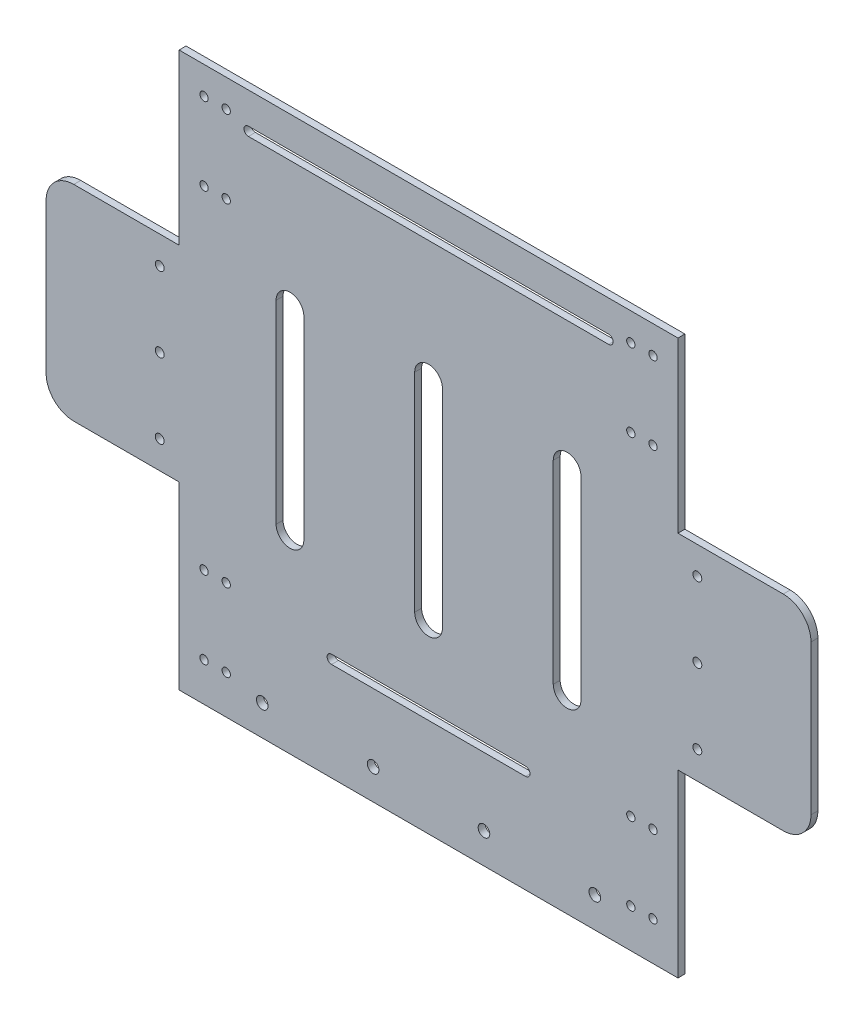
from build123d import *

# Parameters (mm, degrees)
EXTRUDE_1_DEPTH     = 2.5
CUT_EXTRUDE_1_DEPTH = 171.441338882
FILLET_1_R          = 10
FILLET_2_R          = 10
FILLET_3_R          = 10
FILLET_4_R          = 10
SKETCH_5_R          = 2.1
CUT_EXTRUDE_2_DEPTH = 171.441338882
SKETCH_6_R          = 1.5
CUT_EXTRUDE_3_DEPTH = 171.441338882
SKETCH_7_R          = 1.6
CUT_EXTRUDE_4_DEPTH = 171.441338882
CUT_EXTRUDE_5_DEPTH = 171.441338882
CUT_EXTRUDE_6_DEPTH = 171.441338882


with BuildPart() as part:
    # 草图1 → 凸台-拉伸1 (new body)
    with BuildSketch(Plane.XY):
        Polygon((-90, -35), (-90, -100), (90, -100), (90, -35), (138, -35), (138, 39), (90, 39), (90, 100), (-90, 100), (-90, 39), (-138, 39), (-138, -35), align=None)
    extrude(amount=EXTRUDE_1_DEPTH)

    # 草图4 → 切除-拉伸1 (cut, through all)
    with BuildSketch(Plane.XY.offset(2.5)):
        with BuildLine():
            Line((-45, 39.306212286), (-45, -30.693787714))
            ThreePointArc((-45, -30.693787714), (-50, -35.693787714), (-55, -30.693787714))
            Line((-55, -30.693787714), (-55, 39.306212286))
            ThreePointArc((-55, 39.306212286), (-50, 44.306212286), (-45, 39.306212286))
        make_face()
        with BuildLine():
            Line((5, 41.806212286), (5, -33.193787714))
            ThreePointArc((5, -33.193787714), (0, -38.193787714), (-5, -33.193787714))
            Line((-5, -33.193787714), (-5, 41.806212286))
            ThreePointArc((-5, 41.806212286), (0, 46.806212286), (5, 41.806212286))
        make_face()
        with BuildLine():
            Line((55, 39.306212286), (55, -30.693787714))
            ThreePointArc((55, -30.693787714), (50, -35.693787714), (45, -30.693787714))
            Line((45, -30.693787714), (45, 39.306212286))
            ThreePointArc((45, 39.306212286), (50, 44.306212286), (55, 39.306212286))
        make_face()
    extrude(amount=-CUT_EXTRUDE_1_DEPTH, mode=Mode.SUBTRACT)

    # 圆角1
    fillet_1_edges = [part.edges().sort_by_distance(p)[0] for p in [
        (-138, 39, 1.25),
    ]]
    fillet(fillet_1_edges, radius=FILLET_1_R)

    # 圆角2
    fillet_2_edges = [part.edges().sort_by_distance(p)[0] for p in [
        (-138, -35, 1.25),
    ]]
    fillet(fillet_2_edges, radius=FILLET_2_R)

    # 圆角3
    fillet_3_edges = [part.edges().sort_by_distance(p)[0] for p in [
        (138, -35, 1.25),
    ]]
    fillet(fillet_3_edges, radius=FILLET_3_R)

    # 圆角4
    fillet_4_edges = [part.edges().sort_by_distance(p)[0] for p in [
        (138, 39, 1.25),
    ]]
    fillet(fillet_4_edges, radius=FILLET_4_R)

    # 草图5 → 切除-拉伸2 (cut, through all)
    with BuildSketch(Plane(origin=(0, 0, 0), x_dir=(-1, 0, 0), z_dir=(0, 0, -1))):
        with Locations((-60, -89)):
            Circle(SKETCH_5_R)
        with Locations((-20, -89)):
            Circle(SKETCH_5_R)
        with Locations((20, -89)):
            Circle(SKETCH_5_R)
        with Locations((60, -89)):
            Circle(SKETCH_5_R)
    extrude(amount=-CUT_EXTRUDE_2_DEPTH, mode=Mode.SUBTRACT)

    # 草图6 → 切除-拉伸3 (cut, through all)
    with BuildSketch(Plane.XY.offset(2.5)):
        with Locations((-81, 90)):
            Circle(SKETCH_6_R)
        with Locations((-73, 90)):
            Circle(SKETCH_6_R)
        with Locations((-81, 62)):
            Circle(SKETCH_6_R)
        with Locations((-73, 62)):
            Circle(SKETCH_6_R)
        with Locations((73, 90)):
            Circle(SKETCH_6_R)
        with Locations((81, 90)):
            Circle(SKETCH_6_R)
        with Locations((73, 62)):
            Circle(SKETCH_6_R)
        with Locations((81, 62)):
            Circle(SKETCH_6_R)
        with Locations((-81, -58)):
            Circle(SKETCH_6_R)
        with Locations((-73, -58)):
            Circle(SKETCH_6_R)
        with Locations((-81, -86)):
            Circle(SKETCH_6_R)
        with Locations((-73, -86)):
            Circle(SKETCH_6_R)
        with Locations((73, -58)):
            Circle(SKETCH_6_R)
        with Locations((81, -58)):
            Circle(SKETCH_6_R)
        with Locations((73, -86)):
            Circle(SKETCH_6_R)
        with Locations((81, -86)):
            Circle(SKETCH_6_R)
    extrude(amount=-CUT_EXTRUDE_3_DEPTH, mode=Mode.SUBTRACT)

    # 草图7 → 切除-拉伸4 (cut, through all)
    with BuildSketch(Plane.XY.offset(2.5)):
        with Locations((-97, 29)):
            Circle(SKETCH_7_R)
        with Locations((-97, 2)):
            Circle(SKETCH_7_R)
        with Locations((-97, -25)):
            Circle(SKETCH_7_R)
        with Locations((97, 29)):
            Circle(SKETCH_7_R)
        with Locations((97, 2)):
            Circle(SKETCH_7_R)
        with Locations((97, -25)):
            Circle(SKETCH_7_R)
    extrude(amount=-CUT_EXTRUDE_4_DEPTH, mode=Mode.SUBTRACT)

    # 草图8 → 切除-拉伸5 (cut, through all)
    with BuildSketch(Plane.XY.offset(2.5)):
        with BuildLine():
            Line((-35, -61.3), (35, -61.3))
            ThreePointArc((35, -61.3), (36.6, -62.9), (35, -64.5))
            Line((35, -64.5), (-35, -64.5))
            ThreePointArc((-35, -64.5), (-36.6, -62.9), (-35, -61.3))
        make_face()
    extrude(amount=-CUT_EXTRUDE_5_DEPTH, mode=Mode.SUBTRACT)

    # 草图9 → 切除-拉伸6 (cut, through all)
    with BuildSketch(Plane.XY.offset(2.5)):
        with BuildLine():
            Line((65, 88.7), (-65, 88.7))
            ThreePointArc((-65, 88.7), (-66.6, 87.1), (-65, 85.5))
            Line((-65, 85.5), (65, 85.5))
            ThreePointArc((65, 85.5), (66.6, 87.1), (65, 88.7))
        make_face()
    extrude(amount=-CUT_EXTRUDE_6_DEPTH, mode=Mode.SUBTRACT)


solid = part.part
